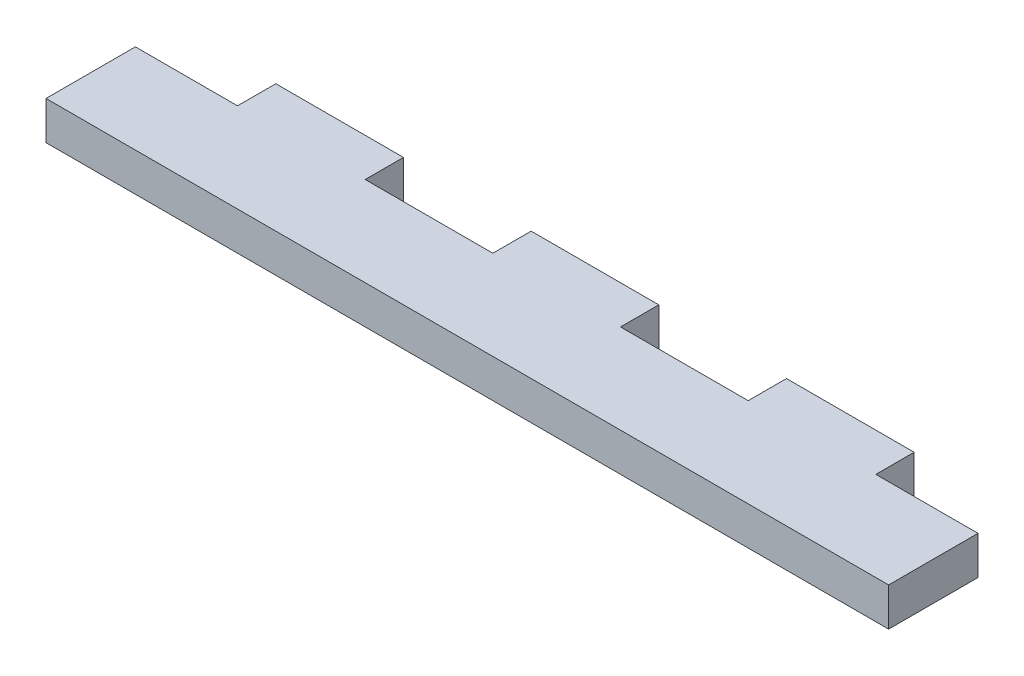
from build123d import *

# Parameters (mm, degrees)
SKETCH1_W           = 66
SKETCH1_H           = 10
BOSS_EXTRUDE1_DEPTH = 3
SKETCH2_W           = 10
SKETCH2_H           = 3
SKETCH2_W_2         = 8
CUT_EXTRUDE1_DEPTH  = 3


with BuildPart() as part:
    # Sketch1 → Boss-Extrude1 (new body)
    with BuildSketch(Plane(origin=(0, 0, 0), x_dir=(1, 0, 0), z_dir=(0, 1, 0))):
        Rectangle(SKETCH1_W, SKETCH1_H)
    extrude(amount=BOSS_EXTRUDE1_DEPTH)

    # Sketch2 → Cut-Extrude1 (cut)
    with BuildSketch(Plane(origin=(0, 3, 0), x_dir=(1, 0, 0), z_dir=(0, 1, 0))):
        with Locations((10, 3.5)):
            Rectangle(SKETCH2_W, SKETCH2_H)
        with Locations((-29, 3.5)):
            Rectangle(SKETCH2_W_2, SKETCH2_H)
        with Locations((-10, 3.5)):
            Rectangle(SKETCH2_W, SKETCH2_H)
        with Locations((29, 3.5)):
            Rectangle(SKETCH2_W_2, SKETCH2_H)
    extrude(amount=-CUT_EXTRUDE1_DEPTH, mode=Mode.SUBTRACT)


solid = part.part
